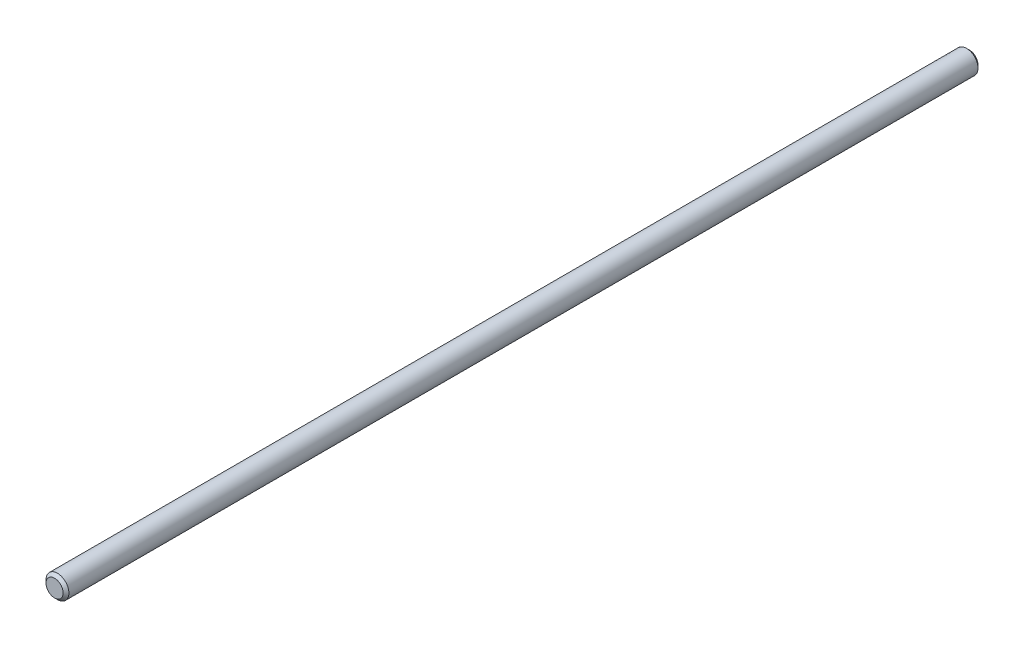
from build123d import *

# Parameters (mm, degrees)
SKETCH2_R           = 2
BOSS_EXTRUDE1_DEPTH = 80
CHAMFER1_SIZE       = 0.5


with BuildPart() as part:
    # Sketch2 → Boss-Extrude1 (new, symmetric)
    with BuildSketch(Plane.XY):
        Circle(SKETCH2_R)
    extrude(amount=BOSS_EXTRUDE1_DEPTH, both=True)

    # Chamfer1
    chamfer1_edges = [part.edges().sort_by_distance(p)[0] for p in [
        (-2, 0, -80),
        (-2, 0, 80),
    ]]
    chamfer(chamfer1_edges, length=CHAMFER1_SIZE)


solid = part.part
